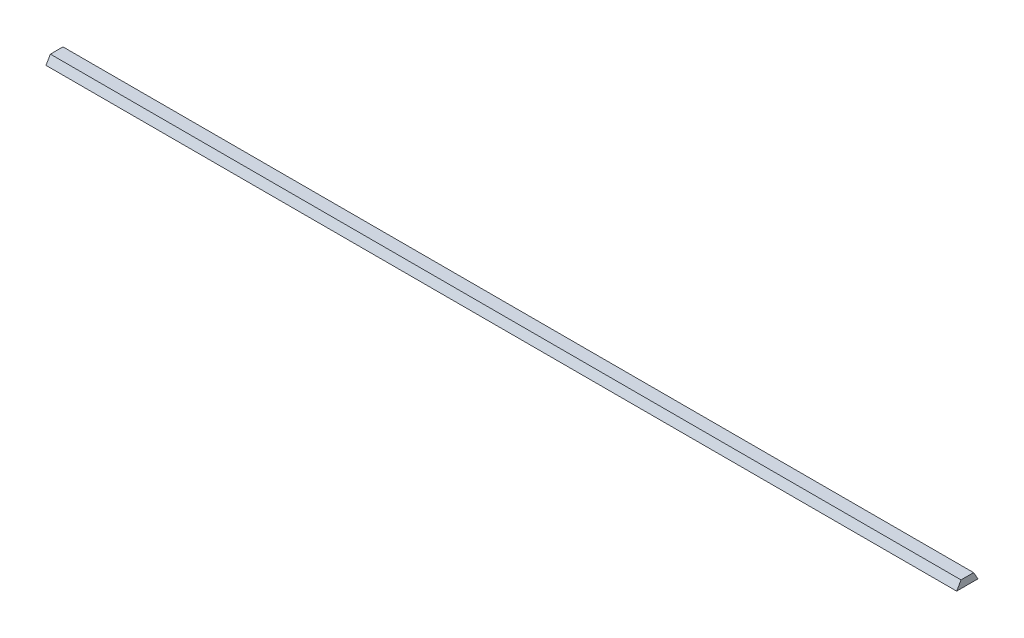
from build123d import *

# Parameters (mm, degrees)
CUT_TO_LENGTH_DEPTH = 2293.413589612


with BuildPart() as part:
    # Sketch1 → Cut To Length (new body)
    with BuildSketch(Plane(origin=(0, 0, 0), x_dir=(0, 0, -1), z_dir=(1, 0, 0))):
        Polygon((26.873522628, 0), (-26.873522628, 0), (-15.875, 19.05), (15.875, 19.05), align=None)
    extrude(amount=CUT_TO_LENGTH_DEPTH)


solid = part.part
